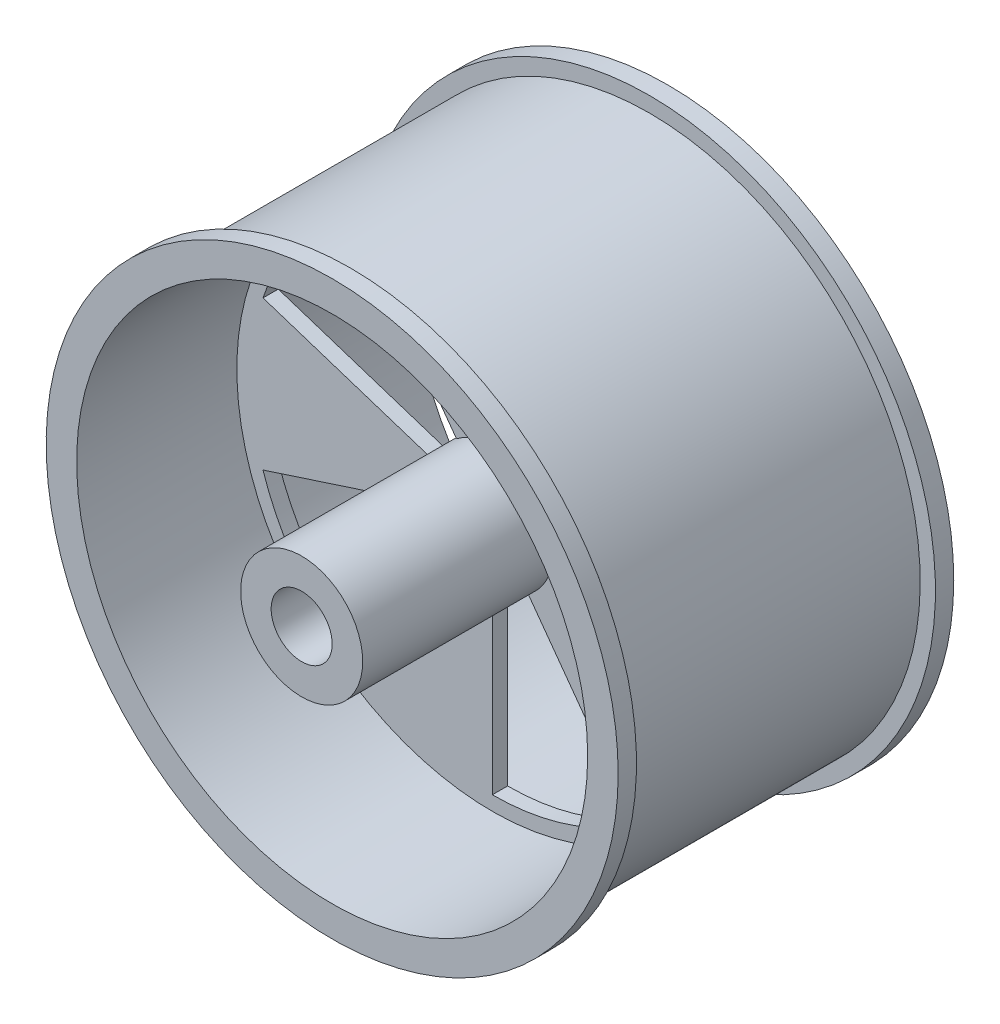
from build123d import *

# Parameters (mm, degrees)
SKETCH1_R               = 23.8125
SKETCH1_R_2             = 21.2725
BOSS_EXTRUDE1_DEPTH     = 27.94
SKETCH2_W               = 24.892
SKETCH2_H               = 1.27
SKETCH5_R               = 21.2725
BOSS_EXTRUDE2_DEPTH     = 0.635
CUT_EXTRUDE2_DEPTH      = 37.706625253
CUT_EXTRUDE2_DEPTH_BACK = 37.706625253
SKETCH7_R               = 5.08
BOSS_EXTRUDE7_DEPTH     = 15.875
SKETCH8_R               = 2.54
CUT_EXTRUDE3_DEPTH      = 19.05


with BuildPart() as part:
    # Sketch1 → Boss-Extrude1 (new body)
    with BuildSketch(Plane.XY):
        Circle(SKETCH1_R)
        Circle(SKETCH1_R_2, mode=Mode.SUBTRACT)
    extrude(amount=BOSS_EXTRUDE1_DEPTH)

    # Sketch2 → Cut-Revolve2 (revolve, cut)
    with BuildSketch(Plane(origin=(0, 0, 0), x_dir=(0, 0, -1), z_dir=(1, 0, 0))):
        with Locations((-13.97, 23.1775)):
            Rectangle(SKETCH2_W, SKETCH2_H)
    revolve(axis=Axis((0, 0, 0), (0, 0, 1)), mode=Mode.SUBTRACT)

    # Sketch5 → Boss-Extrude2 (add, symmetric)
    with BuildSketch(Plane.XY.offset(13.97)):
        Circle(SKETCH5_R)
    extrude(amount=BOSS_EXTRUDE2_DEPTH, both=True)

    # Sketch6 → Cut-Extrude2 (cut, two sides: drawn at the far end of the back side and taken through both)
    with BuildSketch(Plane.XY.offset(14.605).offset(-CUT_EXTRUDE2_DEPTH_BACK)):
        with BuildLine():
            Line((0, 5.08), (0, 20.076289255))
            ThreePointArc((0, 20.076289255), (6.203914564, 19.093685719), (11.800546745, 16.242059191))
            Line((11.800546745, 16.242059191), (2.985949082, 4.109806331))
            ThreePointArc((2.985949082, 4.109806331), (1.569806331, 4.831367103), (0, 5.08))
        make_face()
        with BuildLine():
            Line((4.831367103, 1.569806331), (19.093685719, 6.203914564))
            ThreePointArc((19.093685719, 6.203914564), (20.076289255, 0), (19.093685719, -6.203914564))
            Line((19.093685719, -6.203914564), (4.831367103, -1.569806331))
            ThreePointArc((4.831367103, -1.569806331), (5.08, 0), (4.831367103, 1.569806331))
        make_face()
        with BuildLine():
            Line((2.985949082, -4.109806331), (11.800546745, -16.242059191))
            ThreePointArc((11.800546745, -16.242059191), (6.203914564, -19.093685719), (0, -20.076289255))
            Line((0, -20.076289255), (0, -5.08))
            ThreePointArc((0, -5.08), (1.569806331, -4.831367103), (2.985949082, -4.109806331))
        make_face()
        with BuildLine():
            Line((-2.985949082, -4.109806331), (-11.800546745, -16.242059191))
            ThreePointArc((-11.800546745, -16.242059191), (-16.242059191, -11.800546745), (-19.093685719, -6.203914564))
            Line((-19.093685719, -6.203914564), (-4.831367103, -1.569806331))
            ThreePointArc((-4.831367103, -1.569806331), (-4.109806331, -2.985949082), (-2.985949082, -4.109806331))
        make_face()
        with BuildLine():
            Line((-4.831367103, 1.569806331), (-19.093685719, 6.203914564))
            ThreePointArc((-19.093685719, 6.203914564), (-16.242059191, 11.800546745), (-11.800546745, 16.242059191))
            Line((-11.800546745, 16.242059191), (-2.985949082, 4.109806331))
            ThreePointArc((-2.985949082, 4.109806331), (-4.109806331, 2.985949082), (-4.831367103, 1.569806331))
        make_face()
    extrude(amount=CUT_EXTRUDE2_DEPTH + CUT_EXTRUDE2_DEPTH_BACK, mode=Mode.SUBTRACT)

    # Sketch7 → Boss-Extrude7 (add)
    with BuildSketch(Plane.XY.offset(14.605)):
        Circle(SKETCH7_R)
    extrude(amount=BOSS_EXTRUDE7_DEPTH)

    # Sketch8 → Cut-Extrude3 (cut)
    with BuildSketch(Plane.XY.offset(30.48)):
        Circle(SKETCH8_R)
    extrude(amount=-CUT_EXTRUDE3_DEPTH, mode=Mode.SUBTRACT)


solid = part.part
